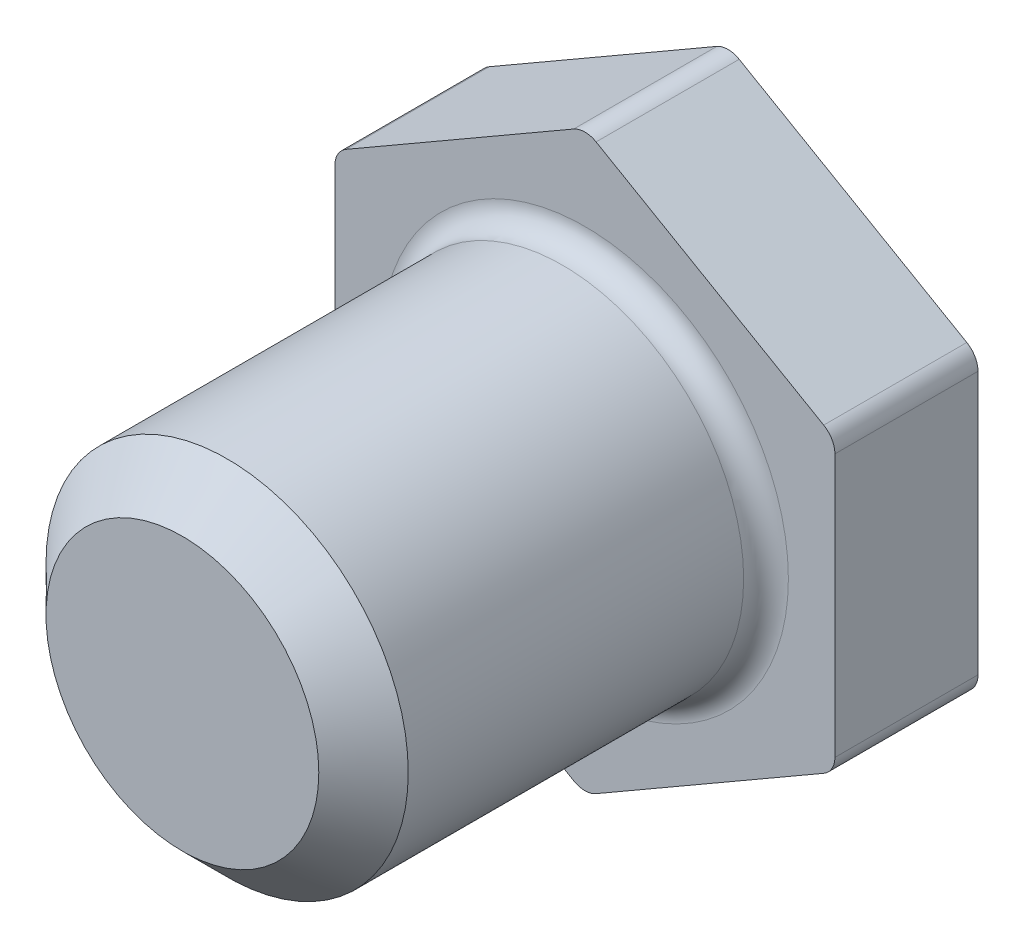
from build123d import *

# Parameters (mm, degrees)
BOSS_EXTRUDE1_DEPTH = 3.2
SKETCH2_R           = 4.05
BOSS_EXTRUDE2_DEPTH = 9
FILLET1_R           = 0.5
CHAMFER1_SIZE       = 1


with BuildPart() as part:
    # Sketch1 → Boss-Extrude1 (new body)
    with BuildSketch(Plane.XY):
        Polygon((5.59, 3.227388005), (0, 6.45477601), (-5.59, 3.227388005), (-5.59, -3.227388005), (0, -6.45477601), (5.59, -3.227388005), align=None)
    extrude(amount=BOSS_EXTRUDE1_DEPTH)

    # Sketch2 → Boss-Extrude2 (add)
    with BuildSketch(Plane.XY.offset(3.2)):
        Circle(SKETCH2_R)
    extrude(amount=BOSS_EXTRUDE2_DEPTH)

    # Fillet1
    fillet1_edges = [part.edges().sort_by_distance(p)[0] for p in [
        (5.59, -3.227388005, 1.6),
        (0, -6.45477601, 1.6),
        (-5.59, -3.227388005, 1.6),
        (-5.59, 3.227388005, 1.6),
        (0, 6.45477601, 1.6),
        (5.59, 3.227388005, 1.6),
        (-4.05, 0, 3.2),
    ]]
    fillet(fillet1_edges, radius=FILLET1_R)

    # Chamfer1
    chamfer1_edges = [part.edges().sort_by_distance(p)[0] for p in [
        (-4.05, 0, 12.2),
    ]]
    chamfer(chamfer1_edges, length=CHAMFER1_SIZE)


solid = part.part
